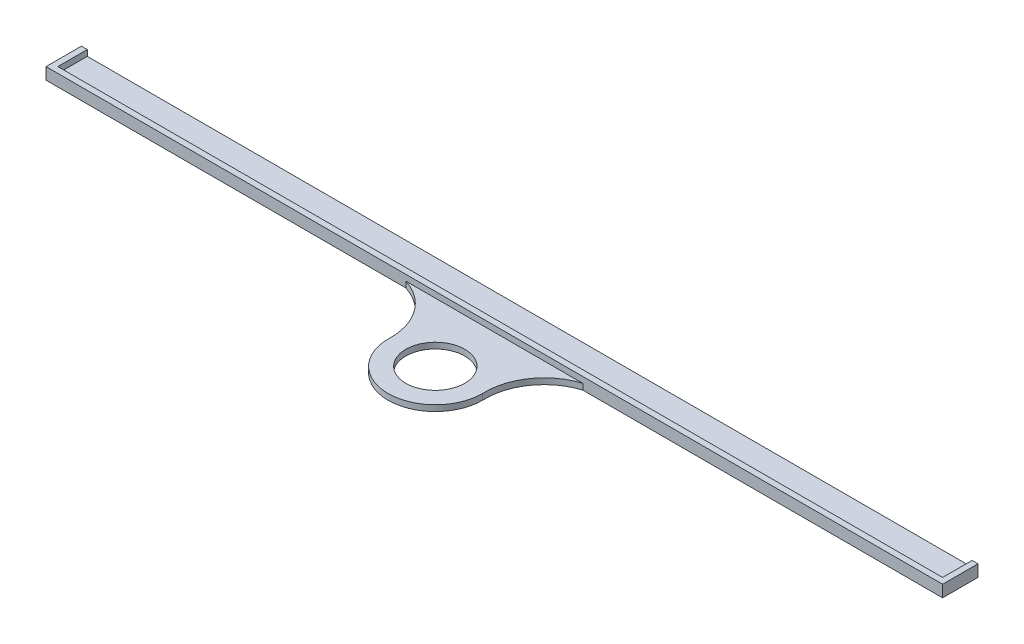
from build123d import *

# Parameters (mm, degrees)
SKETCH2_W           = 304
SKETCH2_H           = 12
SKETCH2_R           = 10
BOSS_EXTRUDE2_DEPTH = 2
SKETCH4_W           = 2
SKETCH4_H           = 10
SKETCH4_H_2         = 2
BOSS_EXTRUDE4_DEPTH = 2


with BuildPart() as part:
    # Sketch2 → Boss-Extrude2 (new body)
    # profile 1 of 3: a face of its own
    with BuildSketch(Plane(origin=(0, 0, 0), x_dir=(1, 0, 0), z_dir=(0, 1, 0))):
        Rectangle(SKETCH2_W, SKETCH2_H)
    # profile 2 of 3: a face of its own
    with BuildSketch(Plane(origin=(0, 0, 0), x_dir=(1, 0, 0), z_dir=(0, 1, 0))):
        with BuildLine():
            Line((30, -6), (-30, -6))
            ThreePointArc((-30, -6), (-19.831001195, -13.285363729), (-15.97933301, -25.187032248))
            ThreePointArc((-15.97933301, -25.187032248), (0, -10), (15.97933301, -25.187032248))
            ThreePointArc((15.97933301, -25.187032248), (19.831001195, -13.285363729), (30, -6))
        make_face()
    # profile 3 of 3: a face of its own
    with BuildSketch(Plane(origin=(0, 0, 0), x_dir=(1, 0, 0), z_dir=(0, 1, 0))):
        with BuildLine():
            ThreePointArc((15.97933301, -25.187032248), (0, -10), (-15.97933301, -25.187032248))
            ThreePointArc((-15.97933301, -25.187032248), (-15.985534015, -25.593621179), (-16, -26))
            ThreePointArc((-16, -26), (0, -42), (16, -26))
            ThreePointArc((16, -26), (15.985534015, -25.593621179), (15.97933301, -25.187032248))
        make_face()
        with Locations(Location((0, -26, 0), (0, 0, 270))):
            Circle(SKETCH2_R, mode=Mode.SUBTRACT)
    extrude(amount=-BOSS_EXTRUDE2_DEPTH)

    # Sketch4 → Boss-Extrude4 (add)
    with BuildSketch(Plane(origin=(0, 0, 0), x_dir=(1, 0, 0), z_dir=(0, 1, 0))):
        with Locations((-151, 1)):
            Rectangle(SKETCH4_W, SKETCH4_H)
        with Locations((-151, -5)):
            Rectangle(SKETCH4_W, SKETCH4_H_2)
        Polygon((0, -4), (-150, -4), (-150, -6), (-30, -6), (0, -6), align=None)
        Polygon((150, -4), (0, -4), (0, -6), (30, -6), (150, -6), align=None)
        with Locations((151, -5)):
            Rectangle(SKETCH4_W, SKETCH4_H_2)
        with Locations((151, 1)):
            Rectangle(SKETCH4_W, SKETCH4_H)
    extrude(amount=BOSS_EXTRUDE4_DEPTH)


solid = part.part
